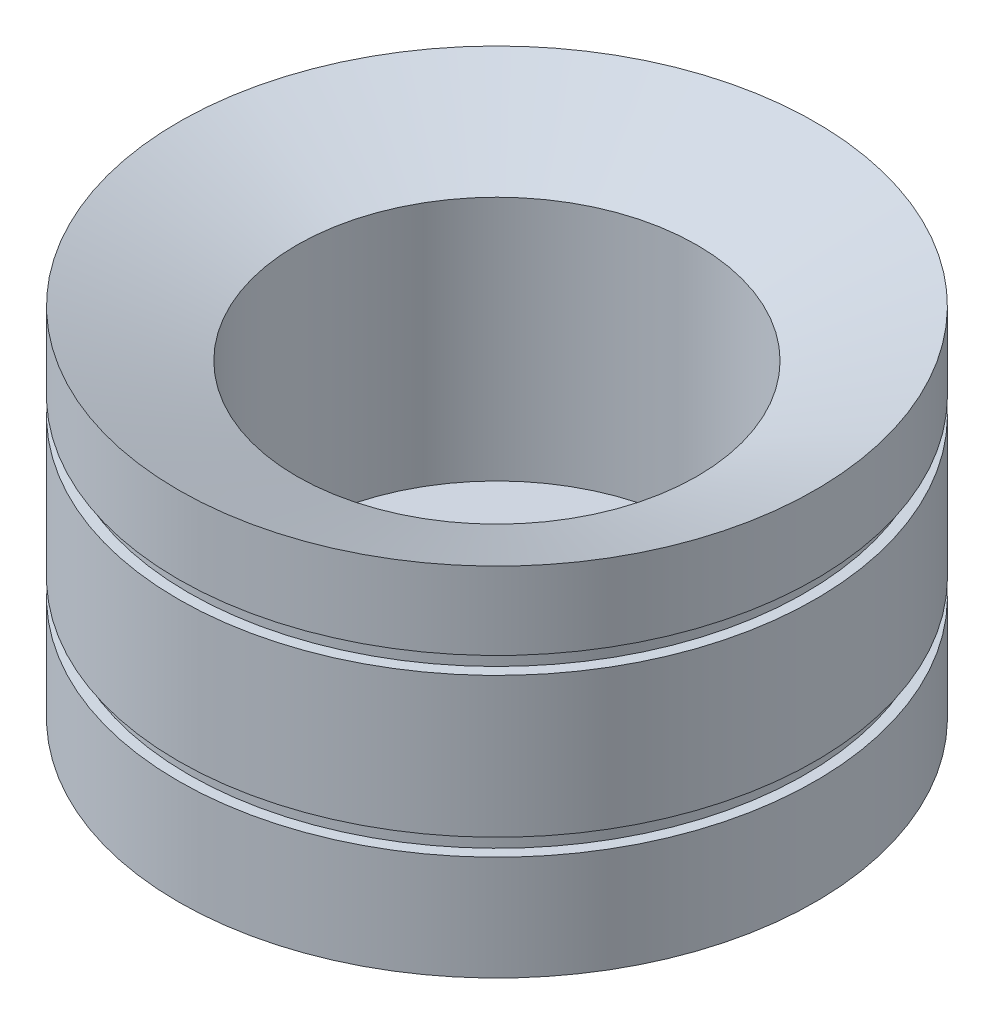
from build123d import *


with BuildPart() as part:
    # Sketch1 → Revolve2 (revolve)
    with BuildSketch(Plane.XY, mode=Mode.PRIVATE) as revolve2_sk:
        Polygon((0, -48.66197009), (-70, -48.66197009), (-70, -25.66197009), (-67.76, -25.544576664), (-67.76, -21.984576664), (-70, -21.867183239), (-70, 8.935869672), (-67.763069842, 9.053102214), (-67.763069842, 12.613102214), (-70, 12.730334756), (-70, 29.730334756), (-44, 19.33802991), (-44, -34.66197009), (0, -34.66197009), align=None)
    revolve(revolve2_sk.sketch.rotate(Axis((0, 54.344805547, 0), (0, -1, 0)), 270), axis=Axis((0, 54.344805547, 0), (0, -1, 0)))


solid = part.part
